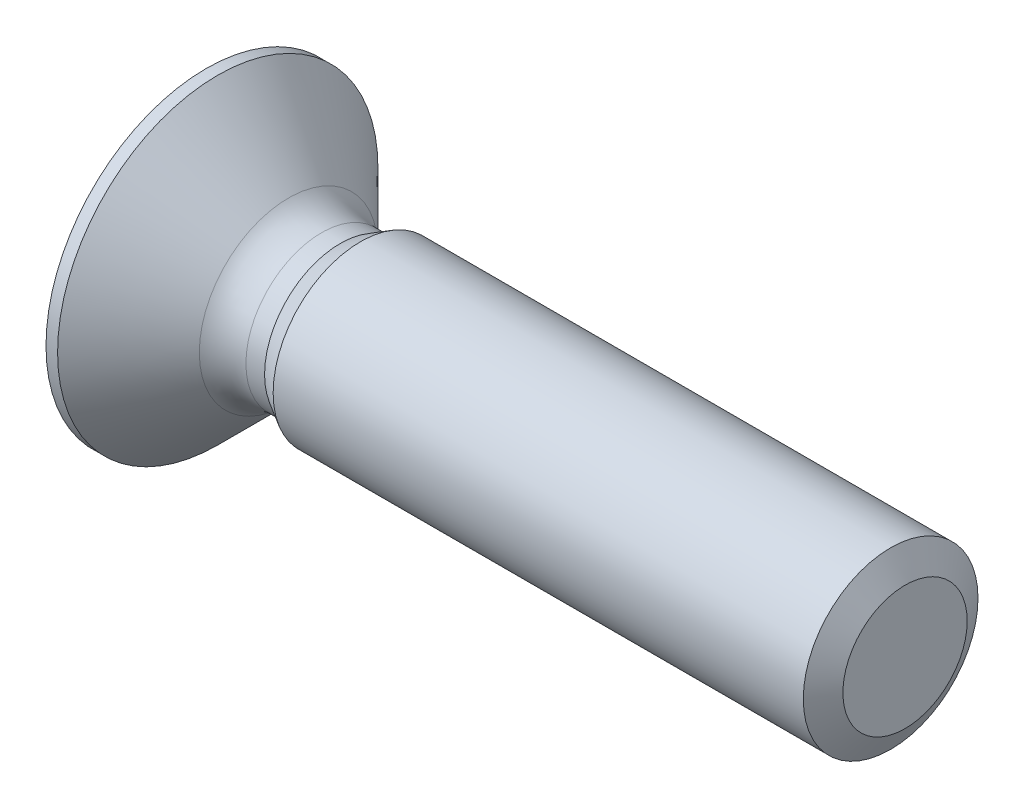
from build123d import *

# Parameters (mm, degrees)
PATTERN_CIRCULAR_1_COUNT = 2
PATTERN_CIRCULAR_1_ANGLE = 90


with BuildPart() as part:
    # 草图1 → Revolve 694 (revolve)
    with BuildSketch(Plane.XY, mode=Mode.PRIVATE) as revolve_694_sk:
        with BuildLine():
            Line((0, 0), (0, 2.75))
            Line((0, 2.75), (0.199, 2.75))
            Line((0.199, 2.75), (1.415685425, 1.533314575))
            ThreePointArc((1.415685425, 1.533314575), (1.675224104, 1.359896374), (1.98137085, 1.299))
            Line((1.98137085, 1.299), (2.301857788, 1.299))
            Line((2.301857788, 1.299), (2.65, 1.5))
            Line((2.65, 1.5), (12, 1.5))
            Line((12, 1.5), (12, 0))
            Line((12, 0), (0, 0))
        make_face()
    revolve(revolve_694_sk.sketch.rotate(Axis((0, 0, 0), (1, 0, 0)), 90), axis=Axis((0, 0, 0), (1, 0, 0)))

    # 草图2 → 切除-旋转1 (revolve, cut)
    with BuildSketch(Plane.XY, mode=Mode.PRIVATE) as cut_revolve_1_sk:
        Polygon((11.752708003, 1.5), (12.252708003, 1.5), (12, 1.067), align=None)
    revolve(cut_revolve_1_sk.sketch.rotate(Axis((0, 0, 0), (-1, 0, 0)), 270), axis=Axis((0, 0, 0), (-1, 0, 0)), mode=Mode.SUBTRACT)

    # 草图3 → 切除-放样1 section 0
    with BuildSketch(Plane.ZY, mode=Mode.PRIVATE) as loft_1_s0:
        with BuildLine():
            Line((-1.6, 0.25), (1.6, 0.25))
            Line((1.6, 0.25), (1.6, -0.25))
            Line((1.6, -0.25), (-1.6, -0.25))
            Line((-1.6, -0.25), (-1.6, 0.25))
        make_face()
    loft_1 = loft([loft_1_s0.sketch, Vertex(2.1, 0, 0)], mode=Mode.SUBTRACT)

    # 阵列(圆周)1: 切除-放样1 ×2 about axis
    pattern_circular_1_axis = Axis((0, 0, 0), (1, 0, 0))
    for i in range(1, PATTERN_CIRCULAR_1_COUNT):
        add(loft_1.rotate(pattern_circular_1_axis, i * PATTERN_CIRCULAR_1_ANGLE / (PATTERN_CIRCULAR_1_COUNT - 1)), mode=Mode.SUBTRACT)


solid = part.part
